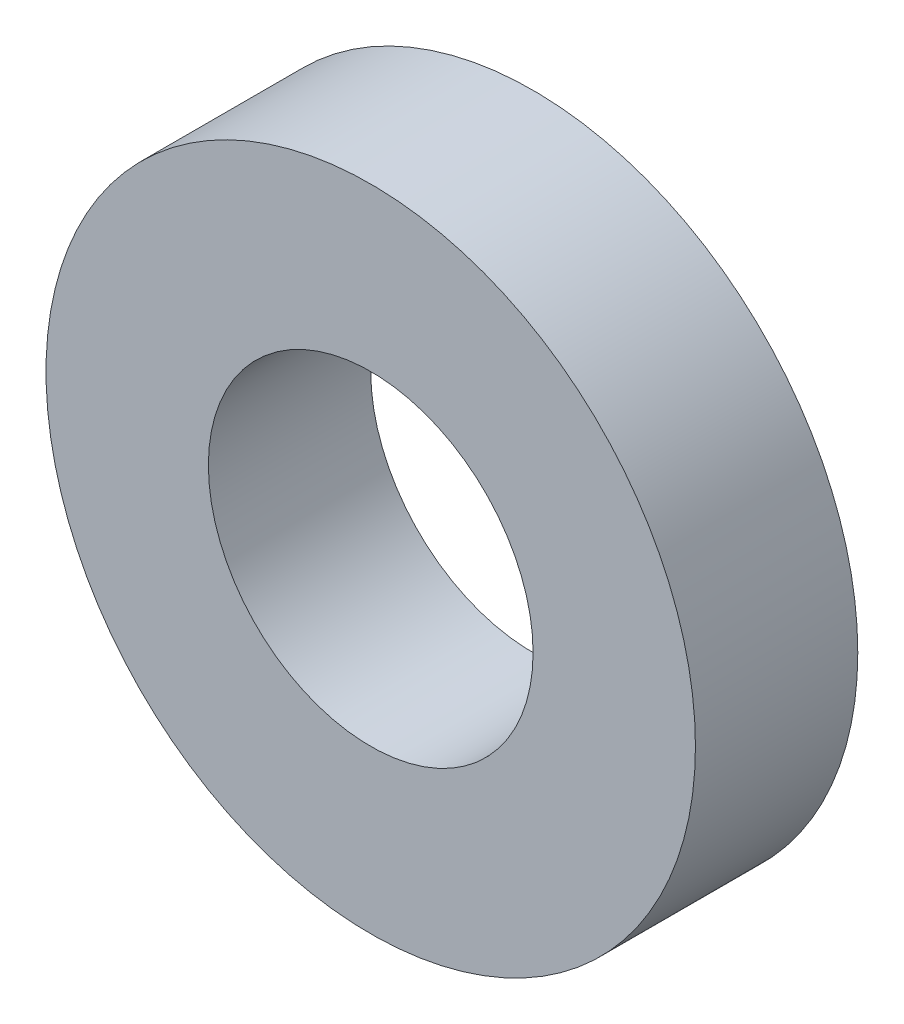
from build123d import *

# Parameters (mm, degrees)
SKETCH1_R           = 6.35
BOSS_EXTRUDE1_DEPTH = 3.175
SKETCH2_R           = 3.175
CUT_EXTRUDE1_DEPTH  = 3.175


with BuildPart() as part:
    # Sketch1 → Boss-Extrude1 (new body)
    with BuildSketch(Plane.XY):
        Circle(SKETCH1_R)
    extrude(amount=BOSS_EXTRUDE1_DEPTH)

    # Sketch2 → Cut-Extrude1 (cut)
    with BuildSketch(Plane.XY.offset(3.175)):
        Circle(SKETCH2_R)
    extrude(amount=-CUT_EXTRUDE1_DEPTH, mode=Mode.SUBTRACT)


solid = part.part
